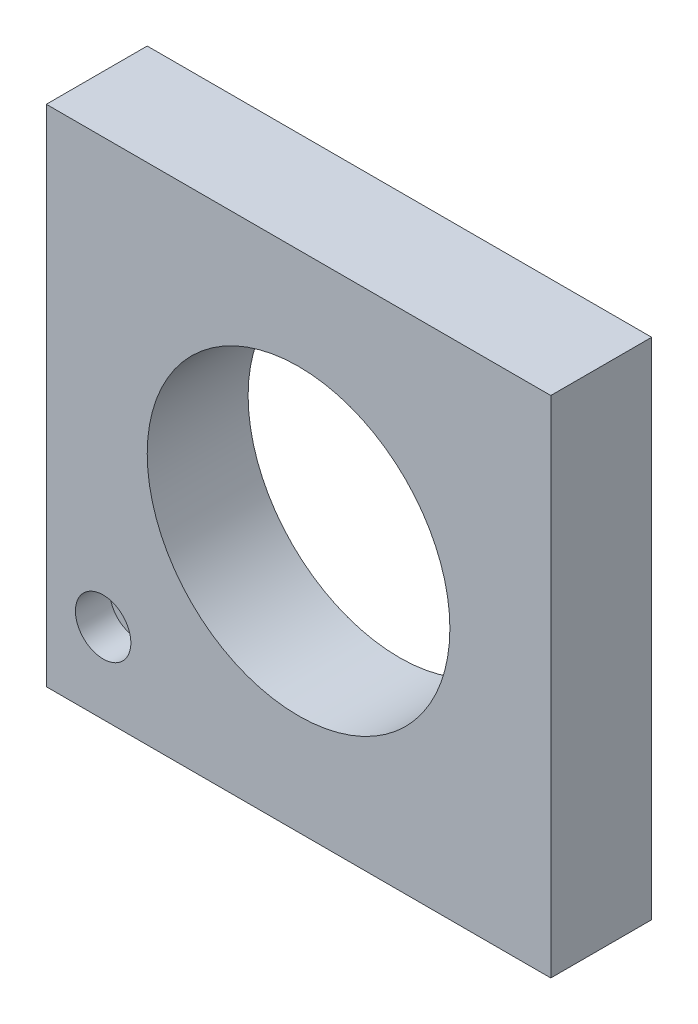
from build123d import *

# Parameters (mm, degrees)
SKETCH_1_W          = 100
SKETCH_1_H          = 100
EXTRUDE_1_DEPTH     = 20
SKETCH_2_R          = 30
CUT_EXTRUDE_1_DEPTH = 20


with BuildPart() as part:
    # 草图1 → 凸台-拉伸1 (new body)
    with BuildSketch(Plane.XY):
        Rectangle(SKETCH_1_W, SKETCH_1_H)
    extrude(amount=EXTRUDE_1_DEPTH)

    # 草图2 → 切除-拉伸1 (cut)
    with BuildSketch(Plane.XY.offset(20)):
        Circle(SKETCH_2_R)
    extrude(amount=-CUT_EXTRUDE_1_DEPTH, mode=Mode.SUBTRACT)

    # 草图3 → M6 六角圆柱头螺钉的柱形沉头孔1 (revolve, cut)
    with BuildSketch(Plane(origin=(-38.736943886, -34.103248867, 20), x_dir=(0, -1, 0), z_dir=(1, 0, 0))):
        Polygon((0, 0), (0, 20), (3.3, 20), (3.3, 6.815021515), (3.325, 6.8), (5.5, 6.8), (5.5, 0), align=None)
    revolve(axis=Axis((-38.736943886, -34.103248867, 26.35), (0, 0, -1)), mode=Mode.SUBTRACT)


solid = part.part
